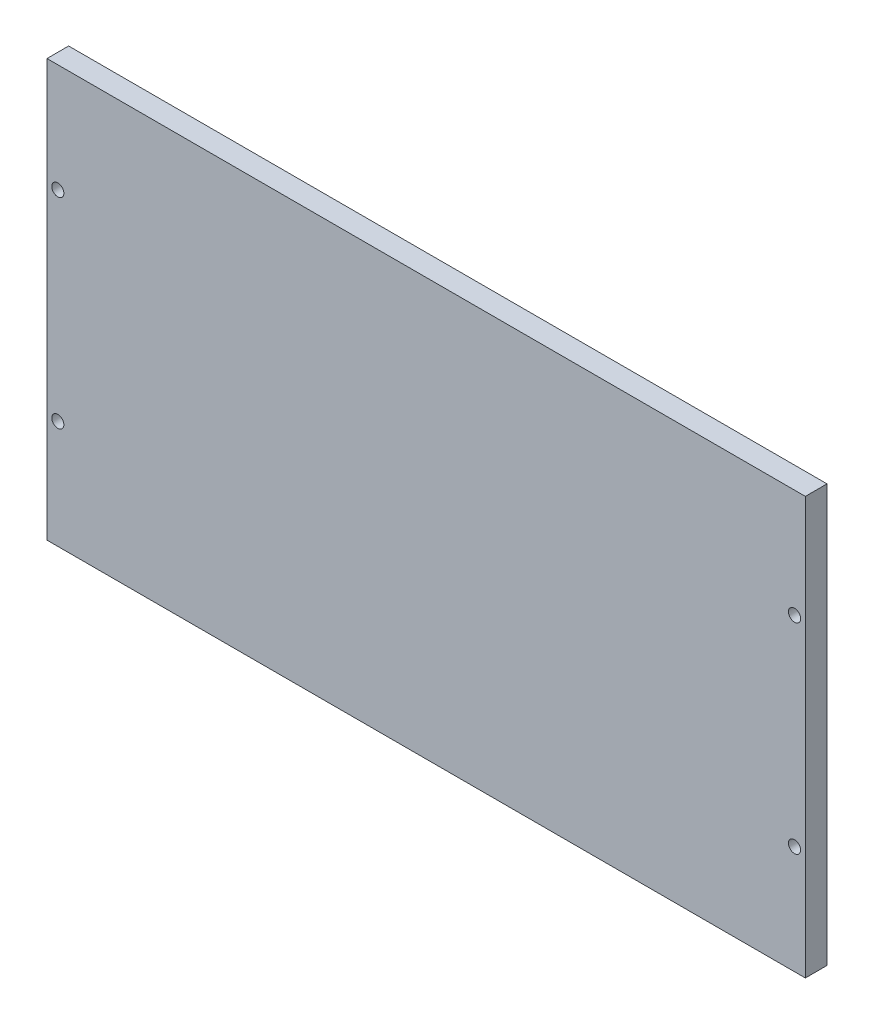
from build123d import *

# Parameters (mm, degrees)
SKETCH1_W           = 177.8
SKETCH1_H           = 97.79
BOSS_EXTRUDE1_DEPTH = 5.08
SKETCH2_R           = 1.4224
CUT_EXTRUDE1_DEPTH  = 25.4


with BuildPart() as part:
    # Sketch1 → Boss-Extrude1 (new body)
    with BuildSketch(Plane.XY):
        with Locations((88.9, 48.895)):
            Rectangle(SKETCH1_W, SKETCH1_H)
    extrude(amount=BOSS_EXTRUDE1_DEPTH)

    # Sketch2 → Cut-Extrude1 (cut)
    with BuildSketch(Plane.XY.offset(5.08)):
        with Locations((2.54, 72.39)):
            Circle(SKETCH2_R)
        with Locations((2.54, 25.4)):
            Circle(SKETCH2_R)
        with Locations((175.26, 25.4)):
            Circle(SKETCH2_R)
        with Locations((175.26, 72.39)):
            Circle(SKETCH2_R)
    extrude(amount=-CUT_EXTRUDE1_DEPTH, mode=Mode.SUBTRACT)


solid = part.part
